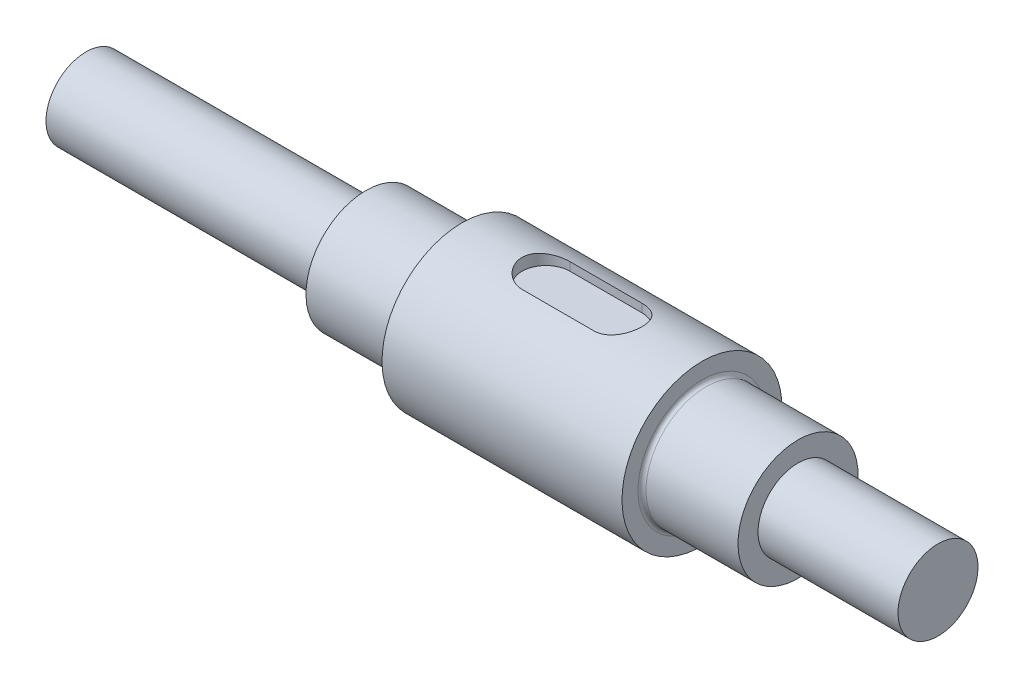
from build123d import *

# Parameters (mm, degrees)
FILLET1_R          = 1
CUT_EXTRUDE1_DEPTH = 3


with BuildPart() as part:
    # Sketch1 → Revolve2 (revolve)
    with BuildSketch(Plane.XY):
        Polygon((-124, 0), (-124, 10), (-54, 10), (-54, 15), (-30, 15), (-30, 20), (30, 20), (30, 15), (54, 15), (54, 10), (89, 10), (89, 0), align=None)
    revolve(axis=Axis((89, 0, 0), (-1, 0, 0)))

    # Fillet1
    fillet1_edges = [part.edges().sort_by_distance(p)[0] for p in [
        (30, -15, 0),
        (-30, -15, 0),
    ]]
    fillet(fillet1_edges, radius=FILLET1_R)

    # Sketch2 → Cut-Extrude1 (cut)
    with BuildSketch(Plane(origin=(0, 20, 0), x_dir=(1, 0, 0), z_dir=(0, 1, 0))):
        with BuildLine():
            Line((9, -6), (-9, -6))
            ThreePointArc((-9, -6), (-15, 0), (-9, 6))
            Line((-9, 6), (9, 6))
            ThreePointArc((9, 6), (15, 0), (9, -6))
        make_face()
    extrude(amount=-CUT_EXTRUDE1_DEPTH, mode=Mode.SUBTRACT)


solid = part.part
